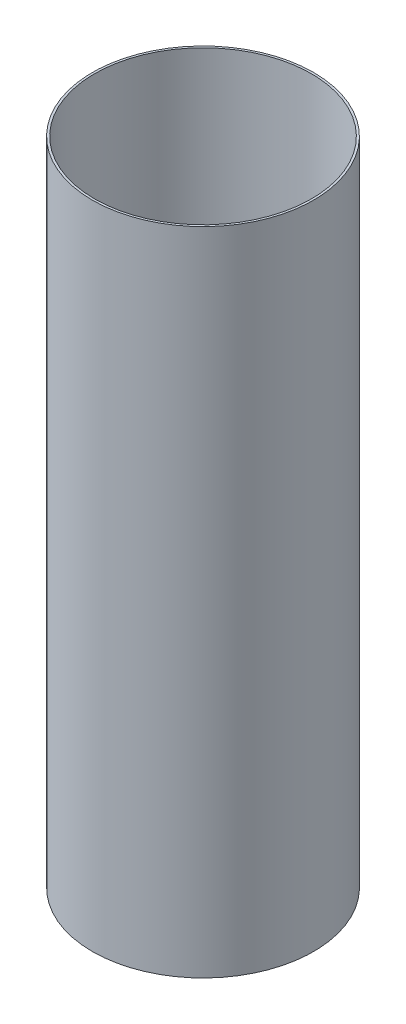
from build123d import *

# Parameters (mm, degrees)
SKETCH1_R           = 51
SKETCH1_R_2         = 50
BOSS_EXTRUDE1_DEPTH = 300


with BuildPart() as part:
    # Sketch1 → Boss-Extrude1 (new body)
    with BuildSketch(Plane(origin=(0, 0, 0), x_dir=(1, 0, 0), z_dir=(0, 1, 0))):
        with Locations(Location((0, 0, 0), (0, 0, 270))):
            Circle(SKETCH1_R)
        with Locations(Location((0, 0, 0), (0, 0, 270))):
            Circle(SKETCH1_R_2, mode=Mode.SUBTRACT)
    extrude(amount=BOSS_EXTRUDE1_DEPTH)


solid = part.part
